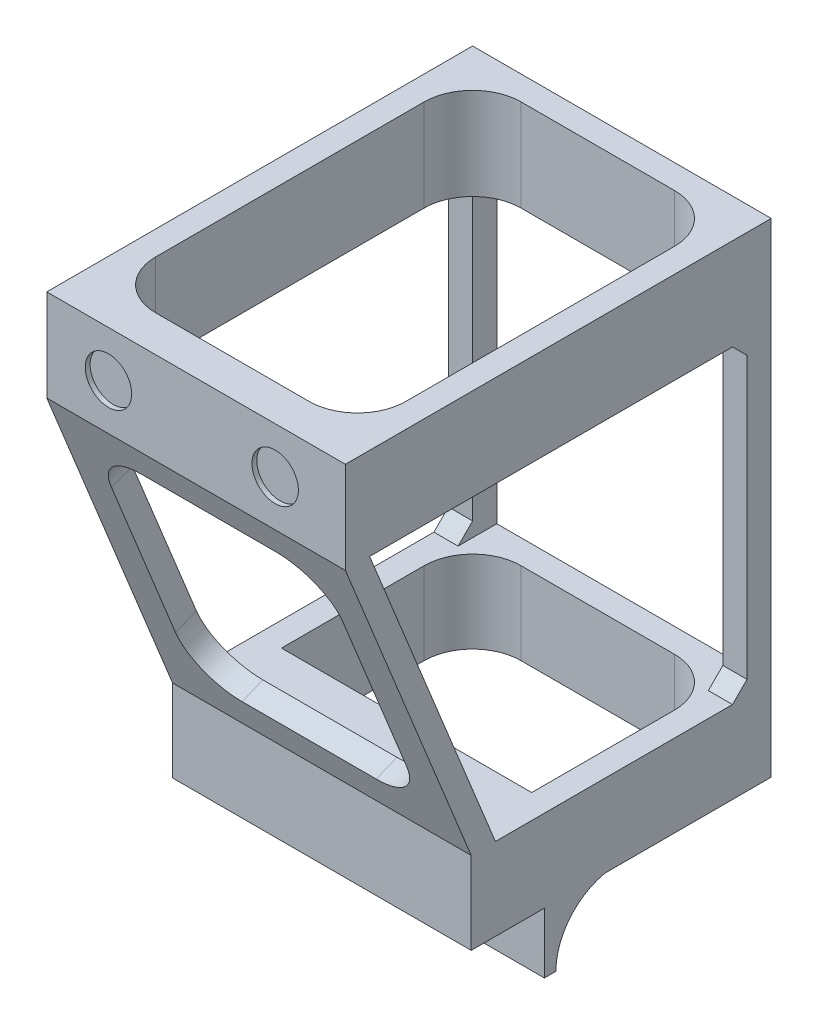
from build123d import *

# Parameters (mm, degrees)
BOSS_EXTRUDE1_DEPTH  = 58.71
SKETCH4_R            = 4.8
CUT_EXTRUDE1_DEPTH   = 1
SKETCH5_R            = 4.8
CUT_EXTRUDE2_DEPTH   = 1
SKETCH6_W            = 19
SKETCH6_H            = 26
BOSS_EXTRUDE3_DEPTH  = 58.71
SKETCH7_W            = 58.71
SKETCH7_H            = 17
SKETCH7_H_2          = 19
BOSS_EXTRUDE4_DEPTH  = 57
BOSS_EXTRUDE5_DEPTH  = 3
CUT_EXTRUDE3_DEPTH   = 17
CUT_EXTRUDE4_START   = -19
CUT_EXTRUDE4_DEPTH   = 19
CUT_EXTRUDE5_DEPTH   = 4.632332886
SKETCH12_W           = 5
SKETCH12_H           = 5
BOSS_EXTRUDE6_DEPTH  = 100
CHAMFER1_SIZE        = 3
SKETCH13_W           = 61.71
SKETCH13_H           = 17.5
BOSS_EXTRUDE7_DEPTH  = 17
SKETCH14_W           = 24.98
SKETCH14_H           = 2.38
SKETCH14_W_2         = 14.02
BOSS_EXTRUDE8_DEPTH  = 12.5
BOSS_EXTRUDE9_DEPTH  = 5
BOSS_EXTRUDE10_START = -5
BOSS_EXTRUDE10_DEPTH = 5


with BuildPart() as part:
    # Sketch3 → Boss-Extrude1 (new body)
    with BuildSketch(Plane.YZ):
        Polygon((0, 5), (0, 0), (17, 0), (81, 26), (100, 26), (100, 31), (81, 31), (17, 5), align=None)
    extrude(amount=BOSS_EXTRUDE1_DEPTH)

    # Sketch4 → Cut-Extrude1 (cut)
    with BuildSketch(Plane.XY.offset(31)):
        with Locations((12.75, 90.5)):
            Circle(SKETCH4_R)
        with Locations((47.2, 90.5)):
            Circle(SKETCH4_R)
    extrude(amount=-CUT_EXTRUDE1_DEPTH, mode=Mode.SUBTRACT)

    # Sketch5 → Cut-Extrude2 (cut)
    with BuildSketch(Plane.XY.offset(5)):
        with Locations((21.94, 8.5)):
            Circle(SKETCH5_R)
        with Locations((36.94, 8.5)):
            Circle(SKETCH5_R)
    extrude(amount=-CUT_EXTRUDE2_DEPTH, mode=Mode.SUBTRACT)

    # Sketch6 → Boss-Extrude3 (add)
    with BuildSketch(Plane.YZ.offset(58.71)):
        with Locations((90.5, 13)):
            Rectangle(SKETCH6_W, SKETCH6_H)
    extrude(amount=-BOSS_EXTRUDE3_DEPTH)

    # Sketch7 → Boss-Extrude4 (add)
    with BuildSketch(Plane(origin=(0, 0, 0), x_dir=(1, 0, 0), z_dir=(0, 0, -1))):
        with Locations((29.355, -8.5)):
            Rectangle(SKETCH7_W, SKETCH7_H)
        with Locations((29.355, -90.5)):
            Rectangle(SKETCH7_W, SKETCH7_H_2)
    extrude(amount=BOSS_EXTRUDE4_DEPTH)

    # Sketch8 → Boss-Extrude5 (add)
    with BuildSketch(Plane.YZ.offset(58.71)):
        Polygon((100, 31), (81, 31), (17, 5), (0, 5), (0, -57), (17, -57), (17, 0), (81, 26), (81, -57), (100, -57), align=None)
    extrude(amount=BOSS_EXTRUDE5_DEPTH)

    # Sketch9 → Cut-Extrude3 (cut)
    with BuildSketch(Plane.XZ):
        with BuildLine():
            Line((15, -2.5), (46.71, -2.5))
            ThreePointArc((46.71, -2.5), (53.781067812, -5.428932188), (56.71, -12.5))
            Line((56.71, -12.5), (56.71, -42))
            ThreePointArc((56.71, -42), (53.781067812, -49.071067812), (46.71, -52))
            Line((46.71, -52), (15, -52))
            ThreePointArc((15, -52), (7.928932188, -49.071067812), (5, -42))
            Line((5, -42), (5, -12.5))
            ThreePointArc((5, -12.5), (7.928932188, -5.428932188), (15, -2.5))
        make_face()
    extrude(amount=-CUT_EXTRUDE3_DEPTH, mode=Mode.SUBTRACT)

    # Sketch10 → Cut-Extrude4 (cut)
    with BuildSketch(Plane(origin=(0, 100, 0), x_dir=(-1, 0, 0), z_dir=(0, 1, 0)).offset(CUT_EXTRUDE4_START)):
        with BuildLine():
            Line((-46.71, 23.5), (-15, 23.5))
            ThreePointArc((-15, 23.5), (-7.928932188, 20.571067812), (-5, 13.5))
            Line((-5, 13.5), (-5, -42))
            ThreePointArc((-5, -42), (-7.928932188, -49.071067812), (-15, -52))
            Line((-15, -52), (-46.71, -52))
            ThreePointArc((-46.71, -52), (-53.781067812, -49.071067812), (-56.71, -42))
            Line((-56.71, -42), (-56.71, 13.5))
            ThreePointArc((-56.71, 13.5), (-53.781067812, 20.571067812), (-46.71, 23.5))
        make_face()
    extrude(amount=CUT_EXTRUDE4_DEPTH, mode=Mode.SUBTRACT)

    # Sketch11 → Cut-Extrude5 (cut)
    with BuildSketch(Plane(origin=(0, 0.664710813, -1.636211232), x_dir=(1, 0, 0), z_dir=(0, -0.376377046955938, 0.9264665771223093))):
        with BuildLine():
            Line((17, 79.711481203), (44.71, 79.711481203))
            ThreePointArc((44.71, 79.711481203), (51.781067812, 76.782549014), (54.71, 69.711481203))
            Line((54.71, 69.711481203), (54.71, 34.631817046))
            ThreePointArc((54.71, 34.631817046), (51.781067812, 27.560749234), (44.71, 24.631817046))
            Line((44.71, 24.631817046), (17, 24.631817046))
            ThreePointArc((17, 24.631817046), (9.928932188, 27.560749234), (7, 34.631817046))
            Line((7, 34.631817046), (7, 69.711481203))
            ThreePointArc((7, 69.711481203), (9.928932188, 76.782549014), (17, 79.711481203))
        make_face()
    extrude(amount=-CUT_EXTRUDE5_DEPTH, mode=Mode.SUBTRACT)

    # Sketch12 → Boss-Extrude6 (add)
    with BuildSketch(Plane.XZ):
        with Locations((2.5, -54.5)):
            Rectangle(SKETCH12_W, SKETCH12_H)
        with Locations((59.21, -54.5)):
            Rectangle(SKETCH12_W, SKETCH12_H)
    extrude(amount=-BOSS_EXTRUDE6_DEPTH)

    # Chamfer1
    chamfer1_edges = [part.edges().sort_by_distance(p)[0] for p in [
        (2.5, 17, -52),
        (2.5, 81, -52),
        (59.21, 81, -52),
        (59.21, 17, -52),
    ]]
    chamfer(chamfer1_edges, length=CHAMFER1_SIZE)

    # Sketch13 → Boss-Extrude7 (add)
    with BuildSketch(Plane.XZ):
        with Locations((30.855, -3.75)):
            Rectangle(SKETCH13_W, SKETCH13_H)
    extrude(amount=-BOSS_EXTRUDE7_DEPTH)

    # Sketch14 → Boss-Extrude8 (add)
    with BuildSketch(Plane.XZ):
        with Locations((12.49, -11.31)):
            Rectangle(SKETCH14_W, SKETCH14_H)
        with Locations((54.7, -11.31)):
            Rectangle(SKETCH14_W_2, SKETCH14_H)
    extrude(amount=BOSS_EXTRUDE8_DEPTH)

    # Sketch15 → Boss-Extrude9 (add)
    with BuildSketch(Plane(origin=(0, 0, 0), x_dir=(0, -1, 0), z_dir=(-1, 0, 0))):
        with BuildLine():
            Line((0, -12.5), (12.5, -12.5))
            ThreePointArc((12.5, -12.5), (4.446217859, -15.360002914), (0, -22.6589186))
            Line((0, -22.6589186), (0, -12.5))
        make_face()
    extrude(amount=-BOSS_EXTRUDE9_DEPTH)

    # Sketch16 → Boss-Extrude10 (add)
    with BuildSketch(Plane.YZ.offset(61.71).offset(BOSS_EXTRUDE10_START)):
        with BuildLine():
            Line((-12.5, -12.5), (0, -12.5))
            Line((0, -12.5), (0, -22.6589186))
            ThreePointArc((0, -22.6589186), (-4.446217859, -15.360002914), (-12.5, -12.5))
        make_face()
    extrude(amount=BOSS_EXTRUDE10_DEPTH)


solid = part.part
